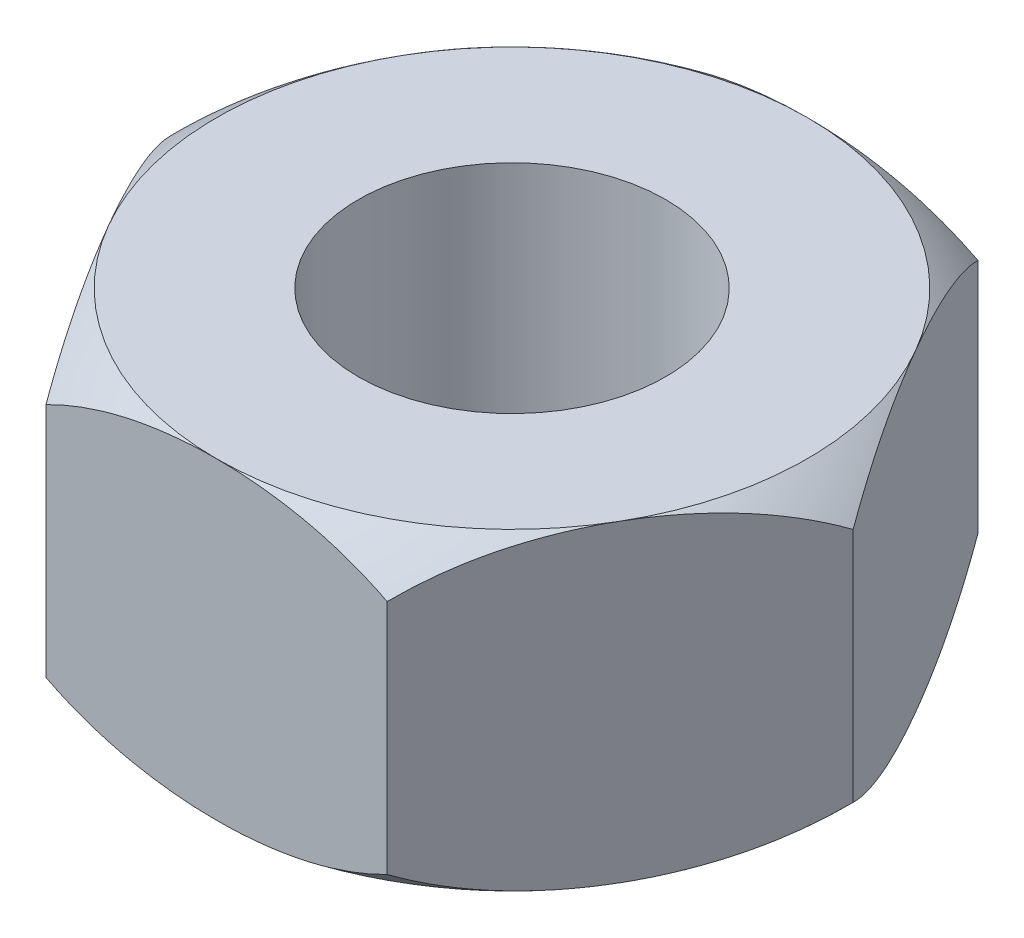
from build123d import *

# Parameters (mm, degrees)
SKETCH1_R      = 3.302
EXTRUDE1_DEPTH = 6.731


with BuildPart() as part:
    # Sketch1 → Extrude1 (new body)
    with BuildSketch(Plane(origin=(0, 0, 0), x_dir=(1, 0, 0), z_dir=(0, 1, 0))):
        Polygon((7.332348419, 0), (3.666174209, 6.35), (-3.666174209, 6.35), (-7.332348419, 0), (-3.666174209, -6.35), (3.666174209, -6.35), align=None)
        with Locations(Location((0, 0, 0), (0, 0, 270))):
            Circle(SKETCH1_R, mode=Mode.SUBTRACT)
    extrude(amount=EXTRUDE1_DEPTH)

    # Sketch2 → Cut-Revolve1 (revolve, cut)
    with BuildSketch(Plane.XY):
        with BuildLine():
            Line((6.35, 6.731), (7.332348419, 6.731))
            Line((7.332348419, 6.731), (7.332348419, 5.9055))
            ThreePointArc((7.332348419, 5.9055), (6.862078786, 6.343126533), (6.35, 6.731))
        make_face()
        with BuildLine():
            Line((7.332348419, 0), (7.332348419, 0.8255))
            ThreePointArc((7.332348419, 0.8255), (6.862078786, 0.387873467), (6.35, 0))
            Line((6.35, 0), (7.332348419, 0))
        make_face()
    revolve(axis=Axis((0, 0, 0), (0, 1, 0)), mode=Mode.SUBTRACT)


solid = part.part
